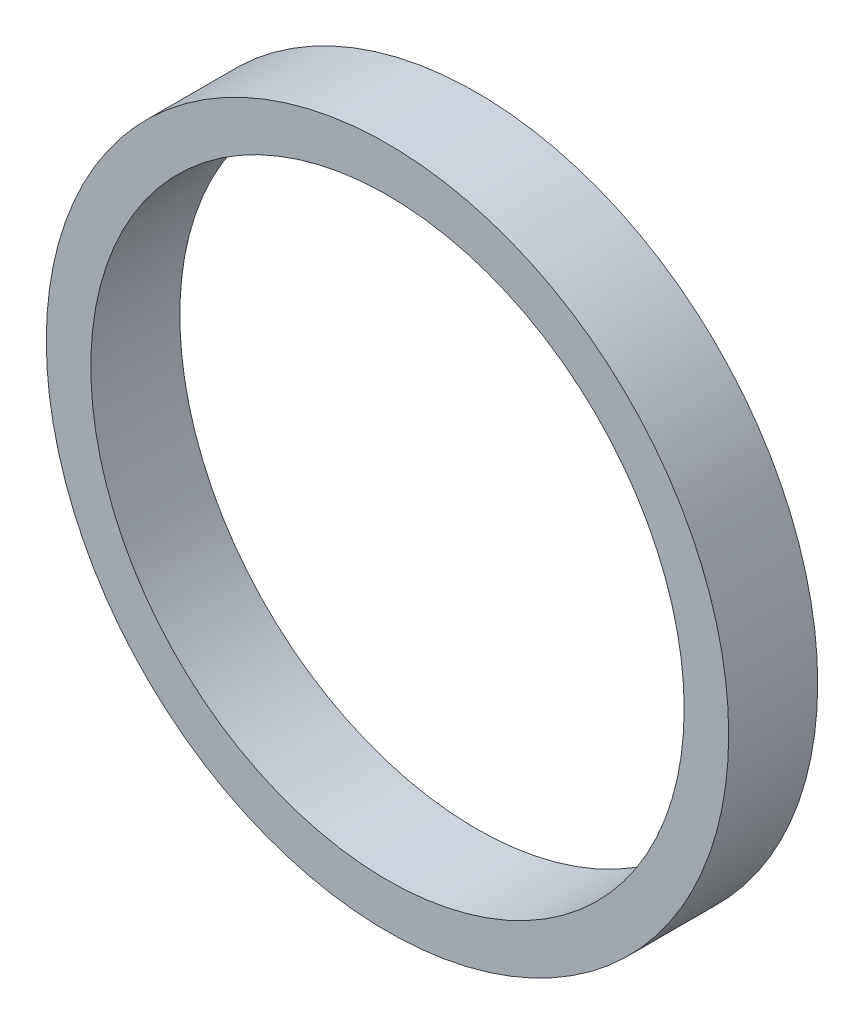
from build123d import *

# Parameters (mm, degrees)
SKETCH_1_R      = 11.5
SKETCH_1_R_2    = 10
EXTRUDE_1_DEPTH = 1.5


with BuildPart() as part:
    # 草图1 → 凸台-拉伸1 (new, symmetric)
    with BuildSketch(Plane.XY):
        Circle(SKETCH_1_R)
        Circle(SKETCH_1_R_2, mode=Mode.SUBTRACT)
    extrude(amount=EXTRUDE_1_DEPTH, both=True)


solid = part.part
